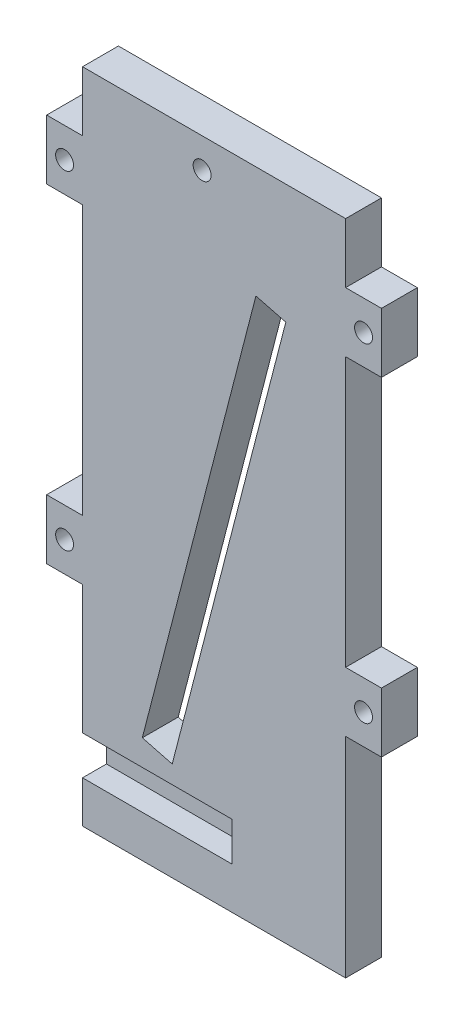
from build123d import *

# Parameters (mm, degrees)
BOSS_EXTRU_1_DEPTH       = 6
ESQUISSE2_R              = 1.5
ENL_V_MAT_EXTRU_1_DEPTH  = 6
ESQUISSE5_R              = 1.5
ENL_V_MAT_EXTRU_6_DEPTH  = 6
ESQUISSE6_R              = 2.995
ENL_V_MAT_EXTRU_7_DEPTH  = 3
ESQUISSE9_W              = 44
ESQUISSE9_H              = 20
BOSS_EXTRU_3_DEPTH       = 6
ESQUISSE10_W             = 25
ESQUISSE10_H             = 6.5
ENL_V_MAT_EXTRU_9_DEPTH  = 4
ENL_V_MAT_EXTRU_11_DEPTH = 6


with BuildPart() as part:
    # Esquisse1 → Boss.-Extru.1 (new body)
    with BuildSketch(Plane.XY):
        Polygon((0, 80), (0, 90), (44, 90), (44, 80), (50, 80), (50, 70), (44, 70), (44, 25), (50, 25), (50, 15), (44, 15), (44, 0), (0, 0), (0, 15), (-6, 15), (-6, 25), (0, 25), (0, 70), (-6, 70), (-6, 80), align=None)
    extrude(amount=BOSS_EXTRU_1_DEPTH)

    # Esquisse2 → Enlèv. mat.-Extru.1 (cut)
    with BuildSketch(Plane.XY.offset(6)):
        with Locations((20, 85)):
            Circle(ESQUISSE2_R)
    extrude(amount=-ENL_V_MAT_EXTRU_1_DEPTH, mode=Mode.SUBTRACT)

    # Esquisse5 → Enlèv. mat.-Extru.6 (cut)
    with BuildSketch(Plane(origin=(0, 0, 0), x_dir=(-1, 0, 0), z_dir=(0, 0, -1))):
        with Locations((3, 75)):
            Circle(ESQUISSE5_R)
        with Locations((3, 20)):
            Circle(ESQUISSE5_R)
        with Locations(Location((-47, 20, 0), (0, 0, 180))):
            Circle(ESQUISSE5_R)
        with Locations(Location((-47, 75, 0), (0, 0, 180))):
            Circle(ESQUISSE5_R)
    extrude(amount=-ENL_V_MAT_EXTRU_6_DEPTH, mode=Mode.SUBTRACT)

    # Esquisse6 → Enlèv. mat.-Extru.7 (cut)
    with BuildSketch(Plane(origin=(0, 0, 0), x_dir=(-1, 0, 0), z_dir=(0, 0, -1))):
        with Locations((3, 20)):
            Circle(ESQUISSE6_R)
        with Locations((3, 75)):
            Circle(ESQUISSE6_R)
        with Locations(Location((-47, 75, 0), (0, 0, 180))):
            Circle(ESQUISSE6_R)
        with Locations(Location((-47, 20, 0), (0, 0, 180))):
            Circle(ESQUISSE6_R)
    extrude(amount=-ENL_V_MAT_EXTRU_7_DEPTH, mode=Mode.SUBTRACT)

    # Esquisse9 → Boss.-Extru.3 (add)
    with BuildSketch(Plane.XY.offset(6)):
        with Locations((22, -10)):
            Rectangle(ESQUISSE9_W, ESQUISSE9_H)
    extrude(amount=-BOSS_EXTRU_3_DEPTH)

    # Esquisse10 → Enlèv. mat.-Extru.9 (cut)
    with BuildSketch(Plane.XY.offset(6)):
        with Locations((12.5, -9.75)):
            Rectangle(ESQUISSE10_W, ESQUISSE10_H)
    extrude(amount=-ENL_V_MAT_EXTRU_9_DEPTH, mode=Mode.SUBTRACT)

    # Esquisse11 → Enlèv. mat.-Extru.11 (cut)
    with BuildSketch(Plane.XY.offset(6)):
        Polygon((29, 71.292517007), (10, -2.207482993), (15, -3.5), (34, 70), align=None)
    extrude(amount=-ENL_V_MAT_EXTRU_11_DEPTH, mode=Mode.SUBTRACT)


solid = part.part
